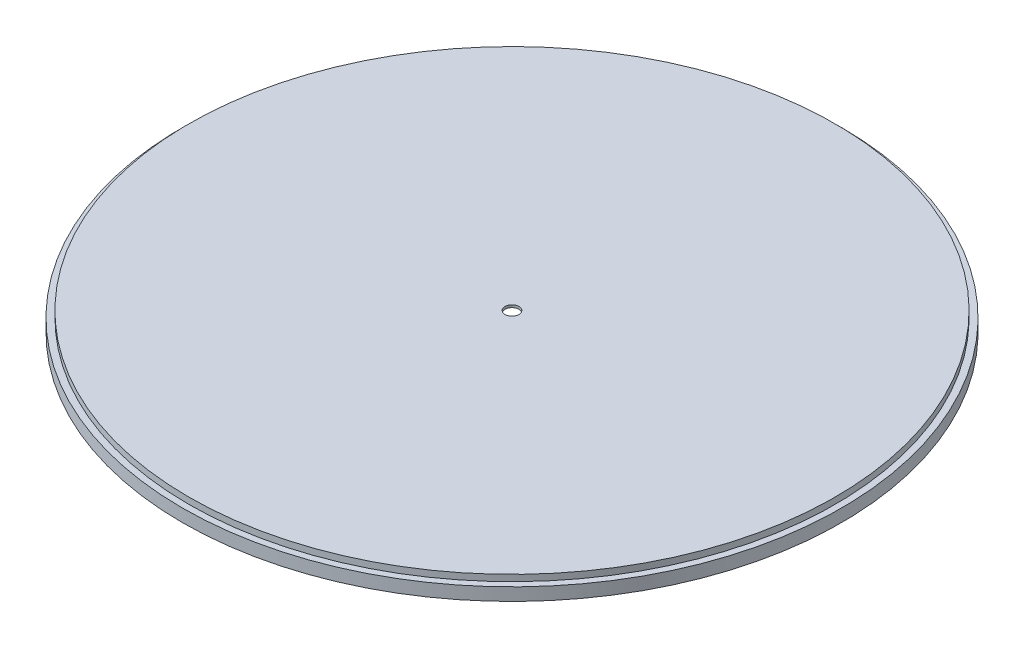
from build123d import *

# Parameters (mm, degrees)
SKETCH1_R           = 25.5
BOSS_EXTRUDE1_DEPTH = 1.5
SKETCH2_R           = 26
BOSS_EXTRUDE2_DEPTH = 1
SKETCH3_R           = 0.55
CUT_EXTRUDE1_DEPTH  = 37.783148315


with BuildPart() as part:
    # Sketch1 → Boss-Extrude1 (new body)
    with BuildSketch(Plane(origin=(0, 0, 0), x_dir=(1, 0, 0), z_dir=(0, 1, 0))):
        with Locations(Location((0, 0, 0), (0, 0, 270))):
            Circle(SKETCH1_R)
    extrude(amount=-BOSS_EXTRUDE1_DEPTH)

    # Sketch2 → Boss-Extrude2 (add)
    with BuildSketch(Plane(origin=(0, -1.5, 0), x_dir=(-1, 0, 0), z_dir=(0, -1, 0))):
        with Locations(Location((0, 0, 0), (0, 0, 90))):
            Circle(SKETCH2_R)
    extrude(amount=-BOSS_EXTRUDE2_DEPTH)

    # Sketch3 → Cut-Extrude1 (cut, through all)
    with BuildSketch(Plane(origin=(0, -0.5, 0), x_dir=(1, 0, 0), z_dir=(0, 1, 0))):
        with Locations(Location((0, 0, 0), (0, 0, 270))):
            Circle(SKETCH3_R)
    extrude(amount=-CUT_EXTRUDE1_DEPTH, mode=Mode.SUBTRACT)

    # Sketch4 → Cut-Revolve1 (revolve, cut)
    with BuildSketch(Plane.XY, mode=Mode.PRIVATE) as cut_revolve1_sk:
        Polygon((-4.35, -1.5), (0, -1.5), (0, 0), (-0.55, 0), (-0.55, -0.2), align=None)
    revolve(cut_revolve1_sk.sketch.rotate(Axis((0, -1.5, 0), (0, 1, 0)), 270), axis=Axis((0, -1.5, 0), (0, 1, 0)), mode=Mode.SUBTRACT)


solid = part.part
